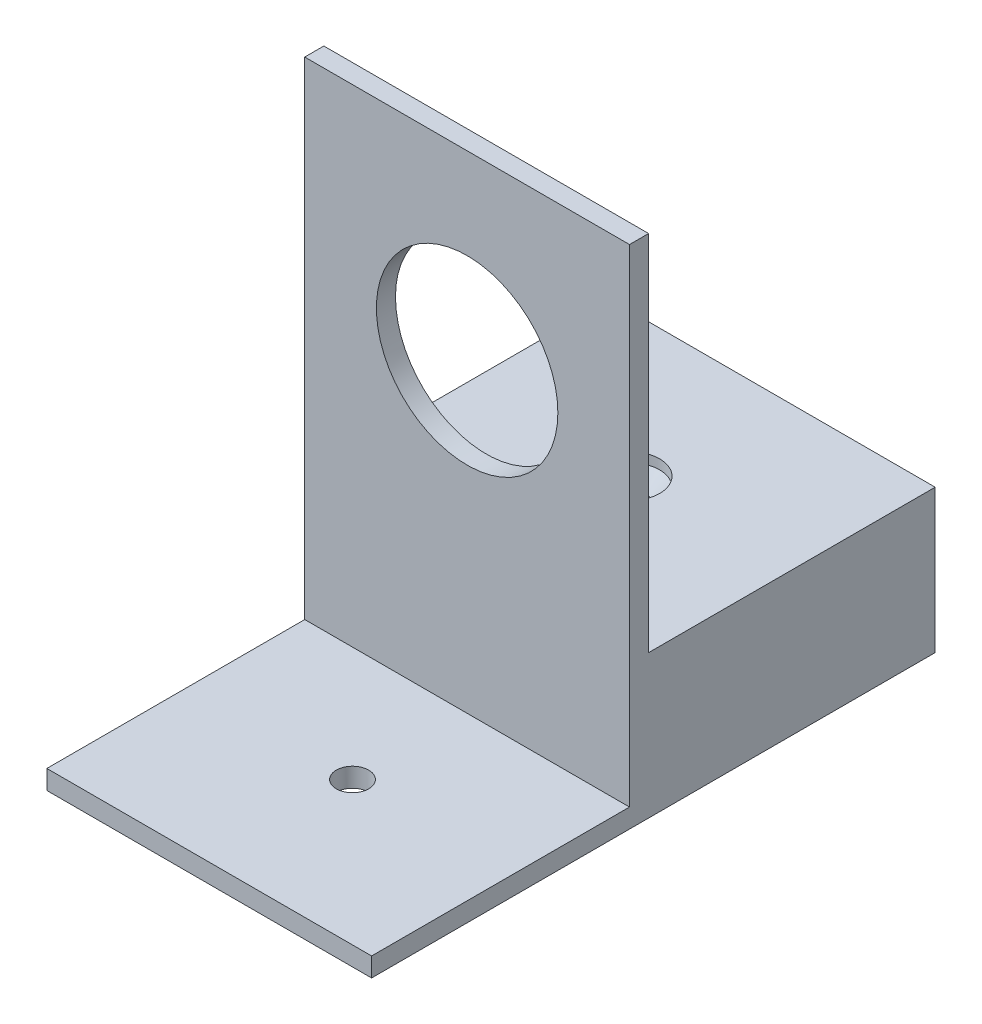
from build123d import *

# Parameters (mm, degrees)
SKETCH1_W                                      = 34
SKETCH1_H                                      = 53
BOSS_EXTRUDE1_DEPTH                            = 2
SKETCH2_W                                      = 34
SKETCH2_H                                      = 2
BOSS_EXTRUDE2_DEPTH                            = 27
SKETCH3_W                                      = 34
SKETCH3_H                                      = 15
BOSS_EXTRUDE3_DEPTH                            = 30
SKETCH4_R                                      = 9.5
CUT_EXTRUDE1_DEPTH                             = 71.632853546
CSK_FOR_M3_FLAT_HEAD_MACHINE_SCREW1_AT_2_COUNT = 2
CSK_FOR_M3_FLAT_HEAD_MACHINE_SCREW1_AT_2_PITCH = 29


with BuildPart() as part:
    # Sketch1 → Boss-Extrude1 (new body)
    with BuildSketch(Plane.XY):
        with Locations((17, 26.5)):
            Rectangle(SKETCH1_W, SKETCH1_H)
    extrude(amount=BOSS_EXTRUDE1_DEPTH)

    # Sketch2 → Boss-Extrude2 (add)
    with BuildSketch(Plane.XY.offset(2)):
        with Locations((17, 1)):
            Rectangle(SKETCH2_W, SKETCH2_H)
    extrude(amount=BOSS_EXTRUDE2_DEPTH)

    # Sketch3 → Boss-Extrude3 (add)
    with BuildSketch(Plane(origin=(0, 0, 0), x_dir=(-1, 0, 0), z_dir=(0, 0, -1))):
        with Locations((-17, 7.5)):
            Rectangle(SKETCH3_W, SKETCH3_H)
    extrude(amount=BOSS_EXTRUDE3_DEPTH)

    # Sketch4 → Cut-Extrude1 (cut, through all)
    with BuildSketch(Plane.XY.offset(2)):
        with Locations((17, 34)):
            Circle(SKETCH4_R)
    extrude(amount=-CUT_EXTRUDE1_DEPTH, mode=Mode.SUBTRACT)

    # Sketch9 → CSK for M3 Flat Head Machine Screw1 (revolve, cut)
    with BuildSketch(Plane(origin=(17, 15, -15), x_dir=(0, 0, 1), z_dir=(1, 0, 0))):
        Polygon((0, 0), (0, 15), (1.7, 15), (1.7, 2.45), (3.15, 1), (3.15, 0), align=None)
    csk_for_m3_flat_head_machine_screw1 = revolve(axis=Axis((17, 21.35, -15), (0, -1, 0)), mode=Mode.SUBTRACT)

    # CSK for M3 Flat Head Machine Screw1 at 2: CSK for M3 Flat Head Machine Screw1 ×2
    with Locations(*[(0, 0, i * CSK_FOR_M3_FLAT_HEAD_MACHINE_SCREW1_AT_2_PITCH) for i in range(1, CSK_FOR_M3_FLAT_HEAD_MACHINE_SCREW1_AT_2_COUNT)]):
        add(csk_for_m3_flat_head_machine_screw1, mode=Mode.SUBTRACT)


solid = part.part
